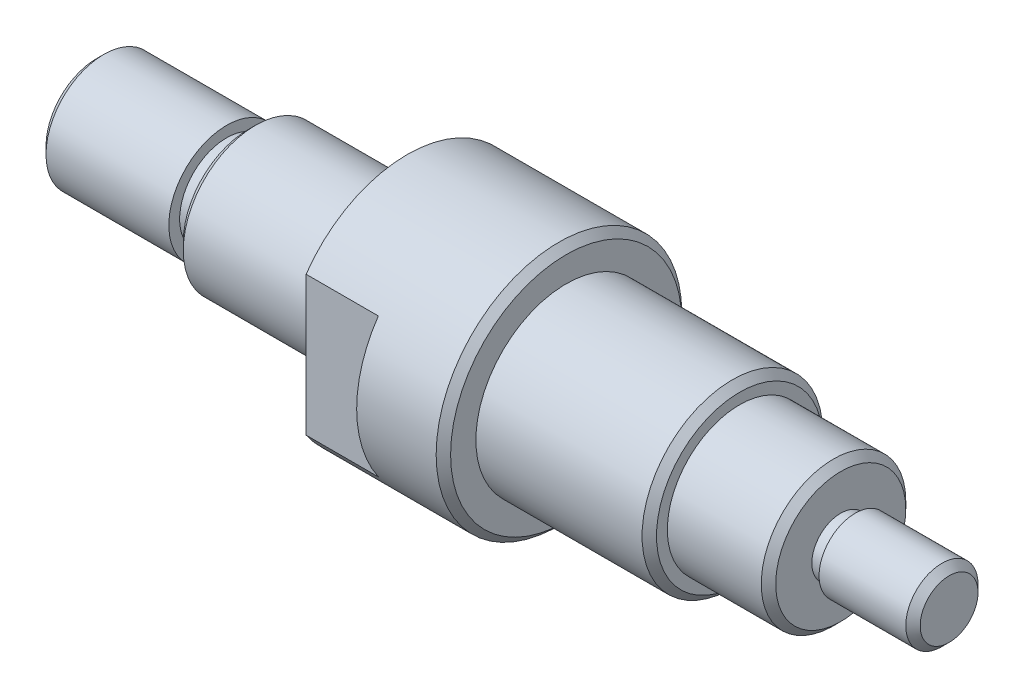
from build123d import *

# Parameters (mm, degrees)
CHAMFER1_SIZE      = 1
CUT_EXTRUDE1_DEPTH = 10


with BuildPart() as part:
    # Sketch1 → Revolve1 (revolve)
    with BuildSketch(Plane.XY, mode=Mode.PRIVATE) as revolve1_sk:
        Polygon((0, 0), (0, 5), (-13, 5), (-13, 4), (-15, 4), (-15, 10), (-29, 10), (-29, 12.5), (-53, 12.5), (-53, 17), (-75, 17), (-75, 10), (-97, 10), (-97, 6.5), (-100, 6.5), (-100, 8), (-118, 8), (-118, 0), align=None)
    revolve(revolve1_sk.sketch.rotate(Axis((0, 0, 0), (-1, 0, 0)), 90), axis=Axis((0, 0, 0), (-1, 0, 0)))

    # Chamfer1
    chamfer1_edges = [part.edges().sort_by_distance(p)[0] for p in [
        (-118, 0, 8),
        (-97, 0, 10),
        (-53, 0, 17),
        (-29, 0, 12.5),
        (-15, 0, 10),
        (0, 0, 5),
    ]]
    chamfer(chamfer1_edges, length=CHAMFER1_SIZE)

    # Sketch2 → Cut-Extrude1 (cut)
    with BuildSketch(Plane.ZY.offset(75)):
        with BuildLine():
            Line((-14, -9.643650761), (-14, 9.643650761))
            ThreePointArc((-14, 9.643650761), (-17, 0), (-14, -9.643650761))
        make_face()
        with BuildLine():
            ThreePointArc((17, 0), (16.232683081, 5.049752469), (14, 9.643650761))
            Line((14, 9.643650761), (14, -9.643650761))
            ThreePointArc((14, -9.643650761), (16.232683081, -5.049752469), (17, 0))
        make_face()
    extrude(amount=-CUT_EXTRUDE1_DEPTH, mode=Mode.SUBTRACT)


solid = part.part
